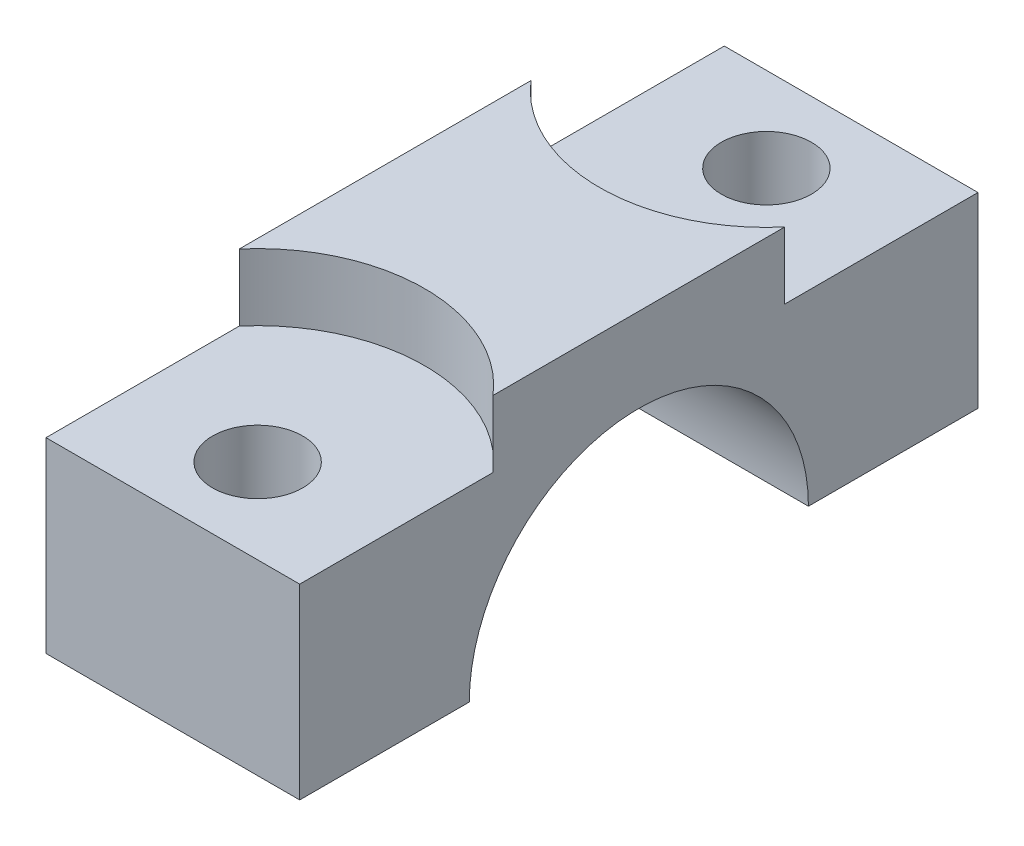
from build123d import *

# Parameters (mm, degrees)
BOSS_EXTRUDE1_DEPTH                           = 9.5
CBORE_FOR_M12_HEX_HEAD_CAP_SCREW2_D           = 6.75
CBORE_FOR_M12_HEX_HEAD_CAP_SCREW2_CBORE_D     = 25
CBORE_FOR_M12_HEX_HEAD_CAP_SCREW2_CBORE_DEPTH = 5


with BuildPart() as part:
    # Sketch1 → Boss-Extrude1 (new, symmetric)
    with BuildSketch(Plane(origin=(0, 0, 0), x_dir=(0, 0, -1), z_dir=(1, 0, 0))):
        with BuildLine():
            ThreePointArc((-12.7, 0), (0, 12.7), (12.7, 0))
            Line((12.7, 0), (25.4, 0))
            Line((25.4, 0), (25.4, 19))
            Line((25.4, 19), (-25.4, 19))
            Line((-25.4, 19), (-25.4, 0))
            Line((-25.4, 0), (-12.7, 0))
        make_face()
    extrude(amount=BOSS_EXTRUDE1_DEPTH, both=True)

    # CBORE for M12 Hex Head Cap Screw2 (through all)
    with Locations(Plane(origin=(0, 19, 0), x_dir=(1, 0, 0), z_dir=(0, 1, 0))):
        with Locations((0, 19.05), (0, -19.05)):
            CounterBoreHole(CBORE_FOR_M12_HEX_HEAD_CAP_SCREW2_D / 2, CBORE_FOR_M12_HEX_HEAD_CAP_SCREW2_CBORE_D / 2, CBORE_FOR_M12_HEX_HEAD_CAP_SCREW2_CBORE_DEPTH)


solid = part.part
